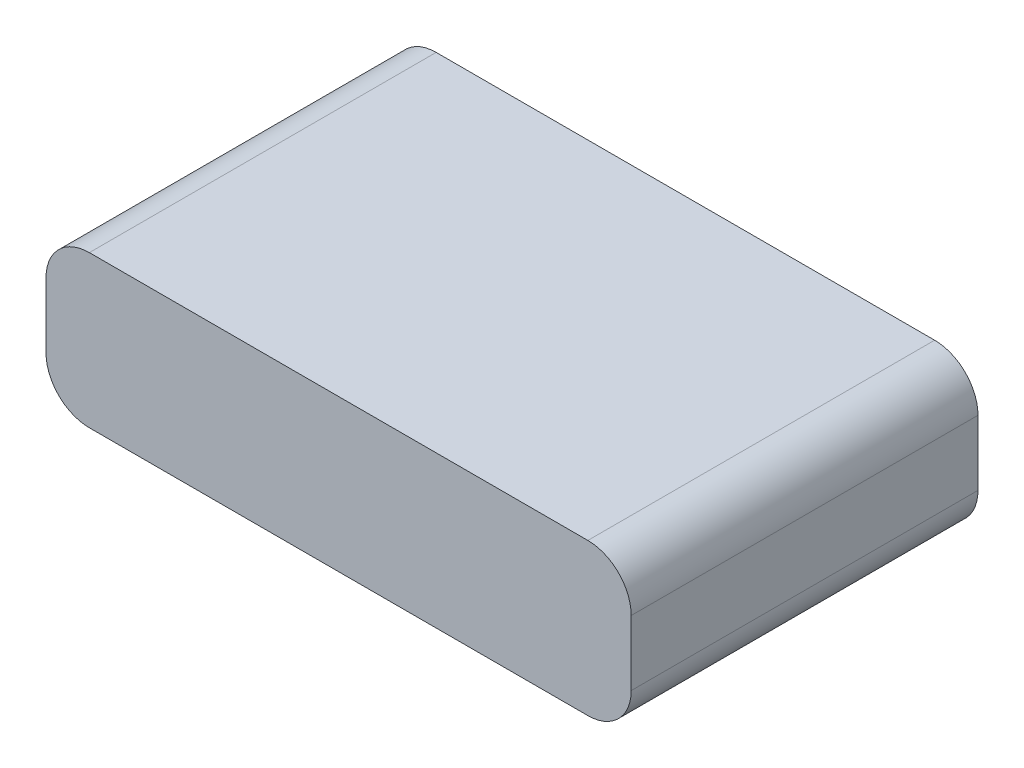
from build123d import *

# Parameters (mm, degrees)
SKETCH_1_W      = 135
SKETCH_1_H      = 35
EXTRUDE_1_DEPTH = 80
FILLET_1_R      = 10


with BuildPart() as part:
    # 草图1 → 凸台-拉伸1 (new body)
    with BuildSketch(Plane.XY):
        with Locations((67.5, 17.5)):
            Rectangle(SKETCH_1_W, SKETCH_1_H)
    extrude(amount=EXTRUDE_1_DEPTH)

    # 圆角1
    fillet_1_edges = [part.edges().sort_by_distance(p)[0] for p in [
        (0, 35, 40),
        (135, 35, 40),
        (135, 0, 40),
        (0, 0, 40),
    ]]
    fillet(fillet_1_edges, radius=FILLET_1_R)


solid = part.part
